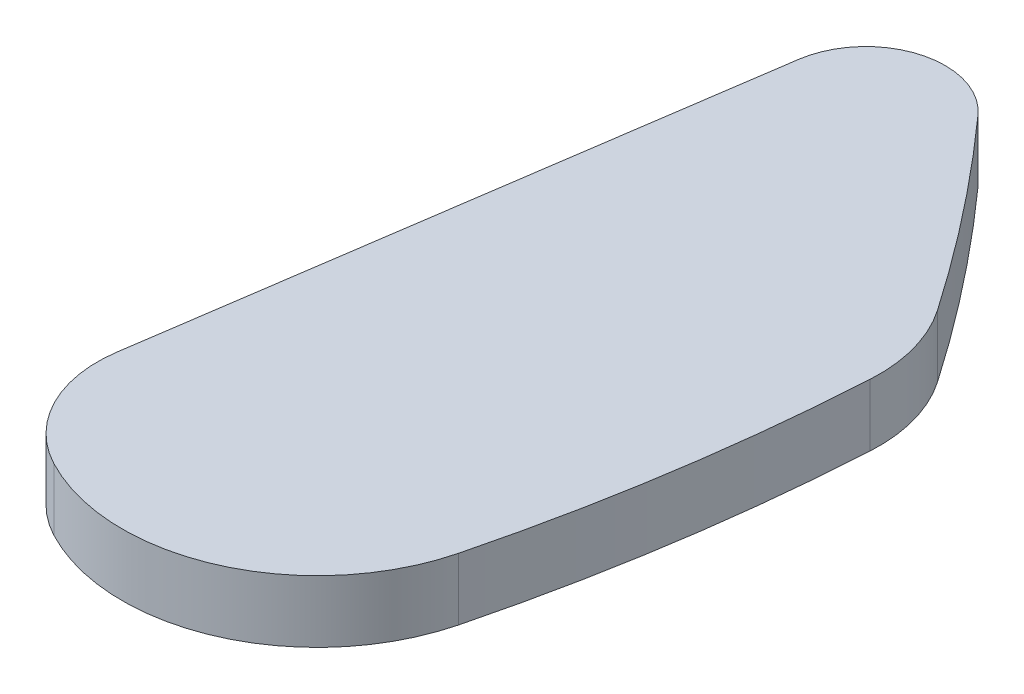
from build123d import *

# Parameters (mm, degrees)
BOSS_EXTRUDE2_DEPTH = 5


with BuildPart() as part:
    # Sketch1 → Boss-Extrude2 (new body)
    with BuildSketch(Plane(origin=(0, 0, 0), x_dir=(1, 0, 0), z_dir=(0, 1, 0))):
        with BuildLine():
            Line((-43.194615771, 148.715173848), (-50.225239518, 100.870673101))
            ThreePointArc((-50.225239518, 100.870673101), (-49.249154262, 94.891853376), (-45.000372743, 90.573649661))
            ThreePointArc((-45.000372743, 90.573649661), (-31.29378116, 90.112244527), (-22.456551163, 100.599709115))
            ThreePointArc((-22.456551163, 100.599709115), (-19.558480324, 114.843106453), (-18.020623668, 129.29676271))
            ThreePointArc((-18.020623668, 129.29676271), (-18.441772746, 133.226047543), (-20.116399197, 136.805470974))
            ThreePointArc((-20.116399197, 136.805470974), (-25.866377757, 144.615905974), (-32.098124488, 152.047627243))
            ThreePointArc((-32.098124488, 152.047627243), (-38.706331156, 153.910886754), (-43.194615771, 148.715173848))
        make_face()
    extrude(amount=BOSS_EXTRUDE2_DEPTH)


solid = part.part
